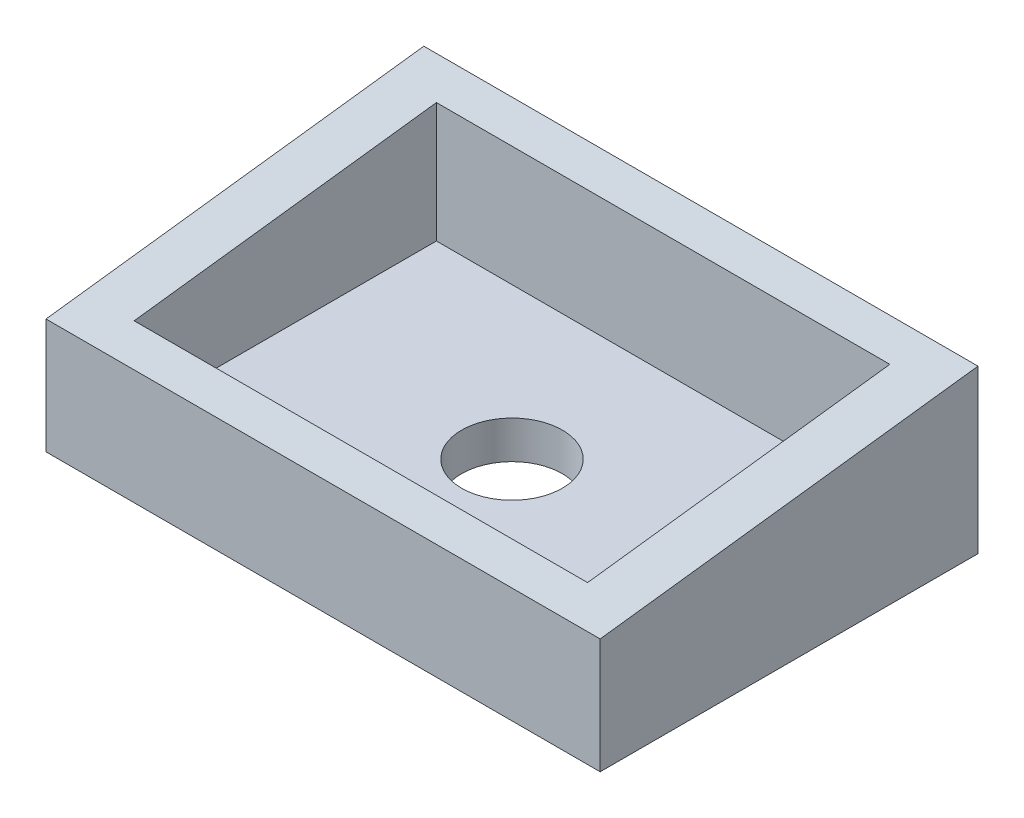
from build123d import *

# Parameters (mm, degrees)
SKETCH2_W               = 22
SKETCH2_H               = 15
BOSS_EXTRUDE1_DEPTH     = 8
CUT_EXTRUDE2_DEPTH      = 27.248809497
CUT_EXTRUDE2_DEPTH_BACK = 27.248809497
SKETCH7_W               = 12
SKETCH7_H               = 5.260019913
CUT_EXTRUDE3_DEPTH      = 18
CUT_EXTRUDE4_DEPTH      = 28.082872227
CUT_EXTRUDE4_DEPTH_BACK = 28.082872227
SKETCH9_R               = 2


with BuildPart() as part:
    # Sketch2 → Boss-Extrude1 (new body)
    with BuildSketch(Plane(origin=(0, 0, 0), x_dir=(1, 0, 0), z_dir=(0, 1, 0))):
        with Locations((11, 7.5)):
            Rectangle(SKETCH2_W, SKETCH2_H)
    extrude(amount=BOSS_EXTRUDE1_DEPTH)

    # Sketch6 → Cut-Extrude2 (cut, two sides: drawn at the far end of the back side and taken through both)
    with BuildSketch(Plane(origin=(2, 0, 0), x_dir=(0, 0, -1), z_dir=(1, 0, 0)).offset(-CUT_EXTRUDE2_DEPTH_BACK)):
        Polygon((-0.545340916, 4.5), (15.415577352, 6.5), (15.415577352, 8.571331794), (-0.545340916, 8.571331794), align=None)
    extrude(amount=CUT_EXTRUDE2_DEPTH + CUT_EXTRUDE2_DEPTH_BACK, mode=Mode.SUBTRACT)

    # Sketch7 → Cut-Extrude3 (cut)
    with BuildSketch(Plane(origin=(2, 0, 0), x_dir=(0, 0, -1), z_dir=(1, 0, 0))):
        with Locations((7.5, 4.130009957)):
            Rectangle(SKETCH7_W, SKETCH7_H)
    extrude(amount=CUT_EXTRUDE3_DEPTH, mode=Mode.SUBTRACT)

    # Sketch9 → Cut-Extrude4 (cut, two sides: drawn at the far end of the back side and taken through both)
    with BuildSketch(Plane(origin=(0, 1.5, 0), x_dir=(1, 0, 0), z_dir=(0, 1, 0)).offset(-CUT_EXTRUDE4_DEPTH_BACK)):
        with Locations(Location((11, 7.5, 0), (0, 0, 270))):
            Circle(SKETCH9_R)
    extrude(amount=CUT_EXTRUDE4_DEPTH + CUT_EXTRUDE4_DEPTH_BACK, mode=Mode.SUBTRACT)


solid = part.part
